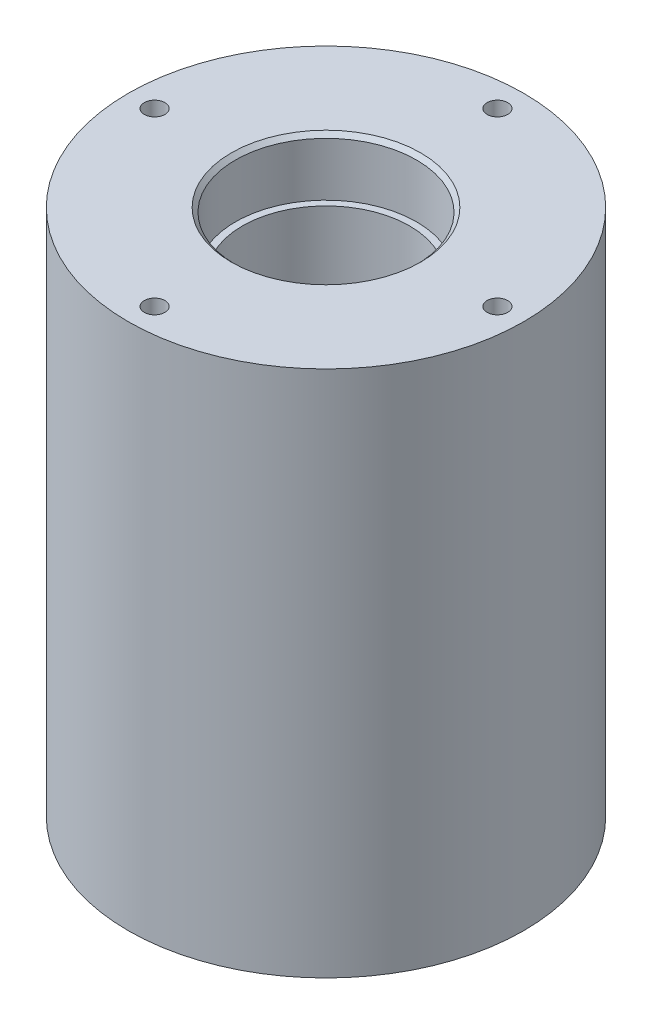
from build123d import *

# Parameters (mm, degrees)
CHAMFER1_SIZE      = 0.5
SKETCH5_R          = 1.25
CUT_EXTRUDE2_DEPTH = 6
CUT_EXTRUDE3_START = -6
SKETCH6_R          = 1.25
CUT_EXTRUDE3_DEPTH = 6


with BuildPart() as part:
    # Sketch4 → Revolve1 (revolve)
    with BuildSketch(Plane.XY, mode=Mode.PRIVATE) as revolve1_sk:
        Polygon((10.99, 88.517868827), (24, 88.517868827), (24, 24.517868827), (10.99, 24.517868827), (10.99, 31.517868827), (10.14, 31.517868827), (10.14, 81.517868827), (10.99, 81.517868827), align=None)
    revolve(revolve1_sk.sketch.rotate(Axis((0, 100.517868827, 0), (0, -1, 0)), 90), axis=Axis((0, 100.517868827, 0), (0, -1, 0)))

    # Chamfer1
    chamfer1_edges = [part.edges().sort_by_distance(p)[0] for p in [
        (0, 88.517868827, -10.99),
        (0, 24.517868827, -10.99),
    ]]
    chamfer(chamfer1_edges, length=CHAMFER1_SIZE)

    # Sketch5 → Cut-Extrude2 (cut)
    with BuildSketch(Plane(origin=(0, 88.517868827, 0), x_dir=(1, 0, 0), z_dir=(0, 1, 0))):
        with Locations(Location((20.8, 0, 0), (0, 0, 270))):
            Circle(SKETCH5_R)
        with Locations(Location((0, 20.8, 0), (0, 0, 270))):
            Circle(SKETCH5_R)
        with Locations(Location((0, -20.8, 0), (0, 0, 270))):
            Circle(SKETCH5_R)
        with Locations(Location((-20.8, 0, 0), (0, 0, 270))):
            Circle(SKETCH5_R)
    extrude(amount=-CUT_EXTRUDE2_DEPTH, mode=Mode.SUBTRACT)

    # Sketch6 → Cut-Extrude3 (cut)
    with BuildSketch(Plane.XZ.offset(-24.517868827).offset(CUT_EXTRUDE3_START)):
        with Locations(Location((0, 20.8, 0), (0, 0, 90))):
            Circle(SKETCH6_R)
        with Locations(Location((20.8, 0, 0), (0, 0, 90))):
            Circle(SKETCH6_R)
        with Locations(Location((-20.8, 0, 0), (0, 0, 90))):
            Circle(SKETCH6_R)
        with Locations(Location((0, -20.8, 0), (0, 0, 90))):
            Circle(SKETCH6_R)
    extrude(amount=CUT_EXTRUDE3_DEPTH, mode=Mode.SUBTRACT)


solid = part.part
